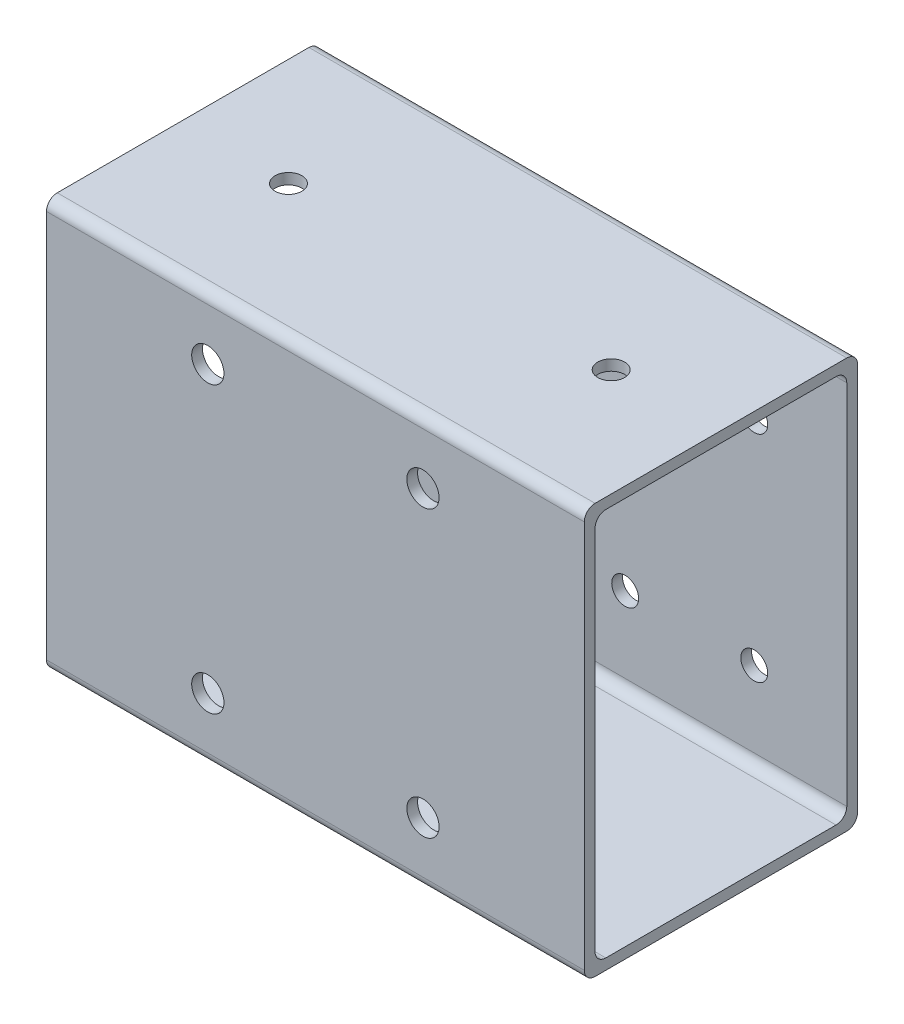
from build123d import *

# Parameters (mm, degrees)
SKETCH1_W             = 50.8
SKETCH1_H             = 76.2
BOSS_EXTRUDE1_DEPTH   = 100
SKETCH2_W             = 46.8
SKETCH2_H             = 72.2
CUT_EXTRUDE1_DEPTH    = 110.985317202
FILLET2_R             = 2
CORTAR_EXTRUIR2_DEPTH = 10
CROQUIS4_R            = 2.5
CORTAR_EXTRUIR5_DEPTH = 10
CROQUIS6_R            = 2.5
CORTAR_EXTRUIR6_DEPTH = 10
CROQUIS7_R            = 2.5
CORTAR_EXTRUIR7_DEPTH = 10


with BuildPart() as part:
    # Sketch1 → Boss-Extrude1 (new body)
    with BuildSketch(Plane(origin=(0, 0, 0), x_dir=(0, 0, -1), z_dir=(1, 0, 0))):
        Rectangle(SKETCH1_W, SKETCH1_H)
    extrude(amount=-BOSS_EXTRUDE1_DEPTH)

    # Sketch2 → Cut-Extrude1 (cut, through all)
    with BuildSketch(Plane(origin=(0, 0, 0), x_dir=(0, 0, -1), z_dir=(1, 0, 0))):
        Rectangle(SKETCH2_W, SKETCH2_H)
    extrude(amount=-CUT_EXTRUDE1_DEPTH, mode=Mode.SUBTRACT)

    # Fillet2
    fillet2_edges = [part.edges().sort_by_distance(p)[0] for p in [
        (-50, -36.1, 23.4),
        (-50, 36.1, 23.4),
        (-50, 36.1, -23.4),
        (-50, -36.1, -23.4),
        (-50, 38.1, 25.4),
        (-50, 38.1, -25.4),
        (-50, -38.1, -25.4),
        (-50, -38.1, 25.4),
    ]]
    fillet(fillet2_edges, radius=FILLET2_R)

    # Croquis2 → Cortar-Extruir2 (cut)
    with BuildSketch(Plane.XY.offset(25.4)):
        with BuildLine():
            ThreePointArc((-27, 26.5), (-30, 29.5), (-33, 26.5))
            Line((-33, 26.5), (-30, 26.5))
            Line((-30, 26.5), (-30, 23.5))
            ThreePointArc((-30, 23.5), (-27.878679656, 24.378679656), (-27, 26.5))
        make_face()
        with BuildLine():
            Line((-30, 26.5), (-33, 26.5))
            ThreePointArc((-33, 26.5), (-32.121320344, 24.378679656), (-30, 23.5))
            Line((-30, 23.5), (-30, 26.5))
        make_face()
        with BuildLine():
            ThreePointArc((-70, 23.5), (-67.878679656, 24.378679656), (-67, 26.5))
            Line((-67, 26.5), (-70, 26.5))
            Line((-70, 26.5), (-70, 23.5))
        make_face()
        with BuildLine():
            Line((-70, 26.5), (-67, 26.5))
            ThreePointArc((-67, 26.5), (-72.121320344, 28.621320344), (-70, 23.5))
            Line((-70, 23.5), (-70, 26.5))
        make_face()
        with BuildLine():
            ThreePointArc((-67, -26.5), (-67.878679656, -24.378679656), (-70, -23.5))
            Line((-70, -23.5), (-70, -26.5))
            Line((-70, -26.5), (-67, -26.5))
        make_face()
        with BuildLine():
            Line((-70, -26.5), (-70, -23.5))
            ThreePointArc((-70, -23.5), (-72.121320344, -28.621320344), (-67, -26.5))
            Line((-67, -26.5), (-70, -26.5))
        make_face()
        with BuildLine():
            ThreePointArc((-27, -26.5), (-27.878679656, -24.378679656), (-30, -23.5))
            Line((-30, -23.5), (-30, -26.5))
            Line((-30, -26.5), (-33, -26.5))
            ThreePointArc((-33, -26.5), (-30, -29.5), (-27, -26.5))
        make_face()
        with BuildLine():
            Line((-30, -26.5), (-30, -23.5))
            ThreePointArc((-30, -23.5), (-32.121320344, -24.378679656), (-33, -26.5))
            Line((-33, -26.5), (-30, -26.5))
        make_face()
    extrude(amount=-CORTAR_EXTRUIR2_DEPTH, mode=Mode.SUBTRACT)

    # Croquis4 → Cortar-Extruir5 (cut)
    with BuildSketch(Plane(origin=(0, 0, -25.4), x_dir=(-1, 0, 0), z_dir=(0, 0, -1))):
        with Locations(Location((90, 23.1, 0), (0, 0, 90))):
            Circle(CROQUIS4_R)
        with Locations(Location((59.2, 23.1, 0), (0, 0, 90))):
            Circle(CROQUIS4_R)
        with Locations(Location((59.2, -23.1, 0), (0, 0, 90))):
            Circle(CROQUIS4_R)
        with Locations(Location((90, -23.1, 0), (0, 0, 90))):
            Circle(CROQUIS4_R)
        with Locations(Location((74.6, 0, 0), (0, 0, 90))):
            Circle(CROQUIS4_R)
    extrude(amount=-CORTAR_EXTRUIR5_DEPTH, mode=Mode.SUBTRACT)

    # Croquis6 → Cortar-Extruir6 (cut)
    with BuildSketch(Plane(origin=(0, 0, -25.4), x_dir=(-1, 0, 0), z_dir=(0, 0, -1))):
        with Locations(Location((17.2, 20, 0), (0, 0, 90))):
            Circle(CROQUIS6_R)
        with Locations(Location((17.2, -20, 0), (0, 0, 90))):
            Circle(CROQUIS6_R)
        with Locations(Location((41.2, -20, 0), (0, 0, 90))):
            Circle(CROQUIS6_R)
        with Locations(Location((41.2, 20, 0), (0, 0, 90))):
            Circle(CROQUIS6_R)
    extrude(amount=-CORTAR_EXTRUIR6_DEPTH, mode=Mode.SUBTRACT)

    # Croquis7 → Cortar-Extruir7 (cut)
    with BuildSketch(Plane(origin=(0, 38.1, 0), x_dir=(1, 0, 0), z_dir=(0, 1, 0))):
        with Locations(Location((-80, -0.4, 0), (0, 0, 270))):
            Circle(CROQUIS7_R)
        with Locations(Location((-20, -0.4, 0), (0, 0, 270))):
            Circle(CROQUIS7_R)
    extrude(amount=-CORTAR_EXTRUIR7_DEPTH, mode=Mode.SUBTRACT)


solid = part.part
